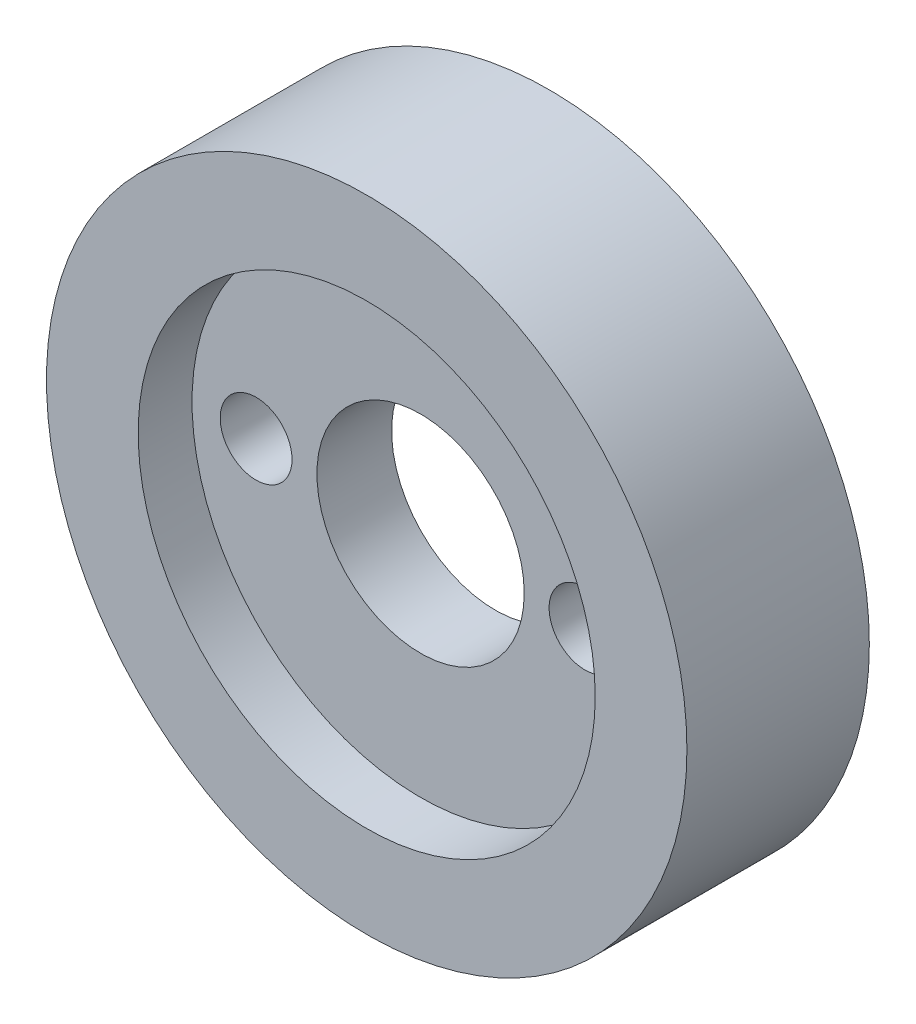
from build123d import *

# Parameters (mm, degrees)
SKETCH1_R           = 9.80909091
SKETCH1_R_2         = 3.175
BOSS_EXTRUDE1_DEPTH = 2.794
CUT_EXTRUDE1_START  = -1.65
SKETCH2_R           = 1.1
CUT_EXTRUDE1_DEPTH  = 1.65
SKETCH2_3_R         = 1.1
CUT_EXTRUDE2_DEPTH  = 15.955342623


with BuildPart() as part:
    # Sketch1 → Boss-Extrude1 (new, symmetric)
    with BuildSketch(Plane.XY):
        Circle(SKETCH1_R)
        Circle(SKETCH1_R_2, mode=Mode.SUBTRACT)
    extrude(amount=BOSS_EXTRUDE1_DEPTH, both=True)

    # Sketch2 → Cut-Extrude1 (cut)
    with BuildSketch(Plane.XY.offset(2.794).offset(CUT_EXTRUDE1_START)):
        with BuildLine():
            ThreePointArc((7, 0), (0, 7), (-7, 0))
            ThreePointArc((-7, 0), (0, -7), (7, 0))
        make_face()
        with BuildLine():
            ThreePointArc((-3.9375, 0), (-5.0375, -1.1), (-6.1375, 0))
            ThreePointArc((-6.1375, 0), (-5.0375, 1.1), (-3.9375, 0))
        make_face(mode=Mode.SUBTRACT)
        with BuildLine():
            ThreePointArc((3.175, 0), (0, -3.175), (-3.175, 0))
            ThreePointArc((-3.175, 0), (0, 3.175), (3.175, 0))
        make_face(mode=Mode.SUBTRACT)
        with Locations((5.0375, 0)):
            Circle(SKETCH2_R, mode=Mode.SUBTRACT)
    cut_extrude1 = extrude(amount=CUT_EXTRUDE1_DEPTH, mode=Mode.SUBTRACT)

    # Mirror1: Cut-Extrude1 across plane
    add(cut_extrude1.mirror(Plane.XY), mode=Mode.SUBTRACT)

    # Sketch2<3> → Cut-Extrude2 (cut, through all)
    with BuildSketch(Plane.XY.offset(2.794)):
        with Locations((-5.0375, 0)):
            Circle(SKETCH2_3_R)
        with Locations((5.0375, 0)):
            Circle(SKETCH2_3_R)
    extrude(amount=-CUT_EXTRUDE2_DEPTH, mode=Mode.SUBTRACT)


solid = part.part
